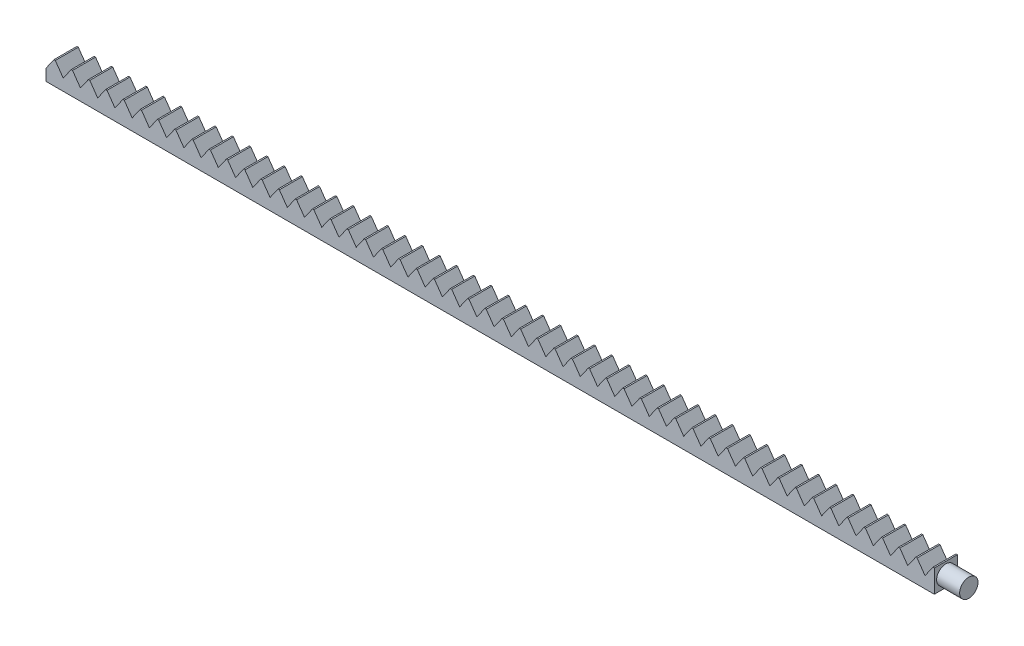
from build123d import *

# Parameters (mm, degrees)
BOSS_EXTRUDE1_DEPTH = 12.7
SKETCH2_W           = 4.3815
SKETCH2_H           = 12.607430492
CUT_EXTRUDE1_DEPTH  = 496.623170669
SKETCH3_R           = 5.08
BOSS_EXTRUDE2_DEPTH = 12.7


with BuildPart() as part:
    # Sketch1 → Boss-Extrude1 (new body)
    with BuildSketch(Plane.XY):
        Polygon((0, 0), (0, 6.35), (4.3815, 12.607430492), (5.1435, 12.607430492), (9.525, 6.35), (13.9065, 12.607430492), (14.6685, 12.607430492), (19.05, 6.35), (23.4315, 12.607430492), (24.1935, 12.607430492), (28.575, 6.35), (32.9565, 12.607430492), (33.7185, 12.607430492), (38.1, 6.35), (42.4815, 12.607430492), (43.2435, 12.607430492), (47.625, 6.35), (52.0065, 12.607430492), (52.7685, 12.607430492), (57.15, 6.35), (61.5315, 12.607430492), (62.2935, 12.607430492), (66.675, 6.35), (71.0565, 12.607430492), (71.8185, 12.607430492), (76.2, 6.35), (80.5815, 12.607430492), (81.3435, 12.607430492), (85.725, 6.35), (90.1065, 12.607430492), (90.8685, 12.607430492), (95.25, 6.35), (99.6315, 12.607430492), (100.3935, 12.607430492), (104.775, 6.35), (109.1565, 12.607430492), (109.9185, 12.607430492), (114.3, 6.35), (118.6815, 12.607430492), (119.4435, 12.607430492), (123.825, 6.35), (128.2065, 12.607430492), (128.9685, 12.607430492), (133.35, 6.35), (137.7315, 12.607430492), (138.4935, 12.607430492), (142.875, 6.35), (147.2565, 12.607430492), (148.0185, 12.607430492), (152.4, 6.35), (156.7815, 12.607430492), (157.5435, 12.607430492), (161.925, 6.35), (166.3065, 12.607430492), (167.0685, 12.607430492), (171.45, 6.35), (175.8315, 12.607430492), (176.5935, 12.607430492), (180.975, 6.35), (185.3565, 12.607430492), (186.1185, 12.607430492), (190.5, 6.35), (194.8815, 12.607430492), (195.6435, 12.607430492), (200.025, 6.35), (204.4065, 12.607430492), (205.1685, 12.607430492), (209.55, 6.35), (213.9315, 12.607430492), (214.6935, 12.607430492), (219.075, 6.35), (223.4565, 12.607430492), (224.2185, 12.607430492), (228.6, 6.35), (232.9815, 12.607430492), (233.7435, 12.607430492), (238.125, 6.35), (242.5065, 12.607430492), (243.2685, 12.607430492), (247.65, 6.35), (252.0315, 12.607430492), (252.7935, 12.607430492), (257.175, 6.35), (261.5565, 12.607430492), (262.3185, 12.607430492), (266.7, 6.35), (271.0815, 12.607430492), (271.8435, 12.607430492), (276.225, 6.35), (280.6065, 12.607430492), (281.3685, 12.607430492), (285.75, 6.35), (290.1315, 12.607430492), (290.8935, 12.607430492), (295.275, 6.35), (299.6565, 12.607430492), (300.4185, 12.607430492), (304.8, 6.35), (309.1815, 12.607430492), (309.9435, 12.607430492), (314.325, 6.35), (318.7065, 12.607430492), (319.4685, 12.607430492), (323.85, 6.35), (328.2315, 12.607430492), (328.9935, 12.607430492), (333.375, 6.35), (337.7565, 12.607430492), (338.5185, 12.607430492), (342.9, 6.35), (347.2815, 12.607430492), (348.0435, 12.607430492), (352.425, 6.35), (356.8065, 12.607430492), (357.5685, 12.607430492), (361.95, 6.35), (366.3315, 12.607430492), (367.0935, 12.607430492), (371.475, 6.35), (375.8565, 12.607430492), (376.6185, 12.607430492), (381, 6.35), (385.3815, 12.607430492), (386.1435, 12.607430492), (390.525, 6.35), (394.9065, 12.607430492), (395.6685, 12.607430492), (400.05, 6.35), (404.4315, 12.607430492), (405.1935, 12.607430492), (409.575, 6.35), (413.9565, 12.607430492), (414.7185, 12.607430492), (419.1, 6.35), (423.4815, 12.607430492), (424.2435, 12.607430492), (428.625, 6.35), (433.0065, 12.607430492), (433.7685, 12.607430492), (438.15, 6.35), (442.5315, 12.607430492), (443.2935, 12.607430492), (447.675, 6.35), (452.0565, 12.607430492), (452.8185, 12.607430492), (457.2, 6.35), (461.5815, 12.607430492), (462.3435, 12.607430492), (466.725, 6.35), (471.1065, 12.607430492), (471.8685, 12.607430492), (476.25, 6.35), (480.6315, 12.607430492), (481.3935, 12.607430492), (485.775, 6.35), (490.1565, 12.607430492), (490.9185, 12.607430492), (495.3, 6.35), (495.3, 0), align=None)
    extrude(amount=BOSS_EXTRUDE1_DEPTH)

    # Sketch2 → Cut-Extrude1 (cut, through all)
    with BuildSketch(Plane.XY.offset(12.7)):
        with Locations((493.10925, 6.303715246)):
            Rectangle(SKETCH2_W, SKETCH2_H)
    extrude(amount=-CUT_EXTRUDE1_DEPTH, mode=Mode.SUBTRACT)

    # Sketch3 → Boss-Extrude2 (add)
    with BuildSketch(Plane(origin=(490.9185, 0, 0), x_dir=(0, 0, -1), z_dir=(1, 0, 0))):
        with Locations(Location((-6.35, 6.303715246, 0), (0, 0, 180))):
            Circle(SKETCH3_R)
    extrude(amount=BOSS_EXTRUDE2_DEPTH)


solid = part.part
